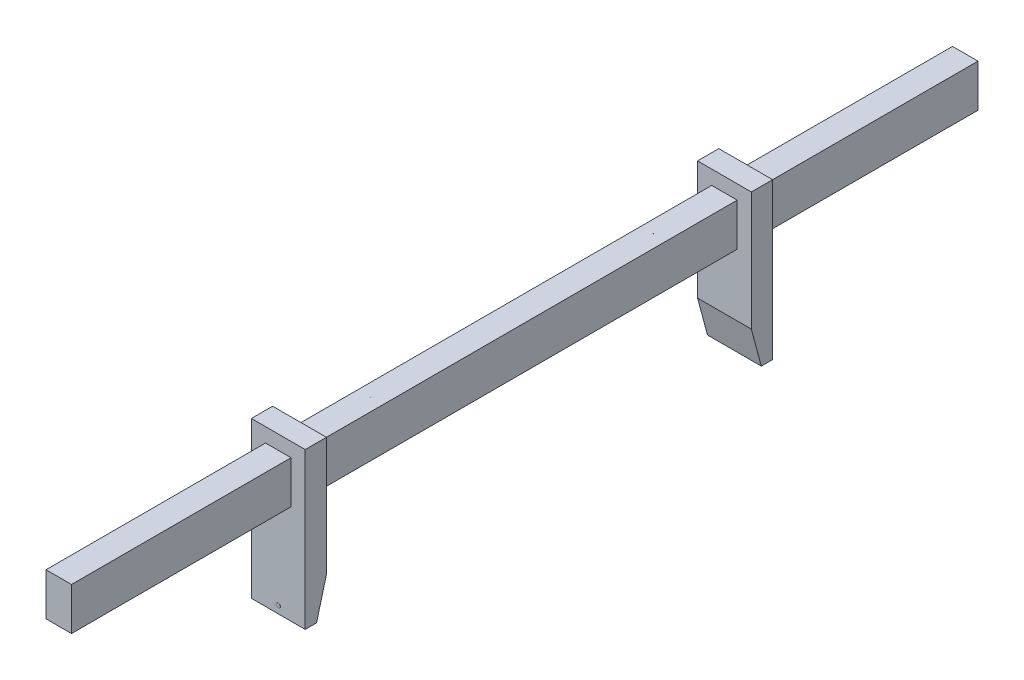
from build123d import *

# Parameters (mm, degrees)
SKETCH_1_W      = 18
SKETCH_1_H      = 30
EXTRUDE_1_DEPTH = 300
EXTRUDE_2_DEPTH = 20
EXTRUDE_3_DEPTH = 38
SKETCH_6_R      = 0.25
EXTRUDE_4_DEPTH = 0.05
SKETCH_8_R      = 1.5
EXTRUDE_5_DEPTH = 0.1


with BuildPart() as part:
    # 草图1 → 凸台-拉伸1 (new, symmetric)
    with BuildSketch(Plane.XY):
        Rectangle(SKETCH_1_W, SKETCH_1_H)
    extrude(amount=EXTRUDE_1_DEPTH, both=True)

    # 草图3 → 凸台-拉伸2 (add)
    with BuildSketch(Plane.XY.offset(300)):
        Polygon((-9, -15), (-9, -15.05), (9, -15.05), (9, -15), (9, 15), (-9, 15), align=None)
    extrude_2 = extrude(amount=EXTRUDE_2_DEPTH)

    # 镜向1: 凸台-拉伸2 across plane
    add(extrude_2.mirror(Plane.XY))

    # 草图5 → 凸台-拉伸3 (add)
    with BuildSketch(Plane(origin=(19, 0, 0), x_dir=(0, 0, -1), z_dir=(1, 0, 0))):
        Polygon((-165, 25), (-165, -85), (-157, -85), (-150, -58.875644347), (-150, 25), align=None)
    extrude_3 = extrude(amount=-EXTRUDE_3_DEPTH)

    # 镜向2: 凸台-拉伸3 across plane
    add(extrude_3.mirror(Plane.XY))

    # 草图6 → 凸台-拉伸4 (add)
    with BuildSketch(Plane(origin=(0, 15, 0), x_dir=(1, 0, 0), z_dir=(0, 1, 0))):
        with Locations(Location((0, 100, 0), (0, 0, 90))):
            Circle(SKETCH_6_R)
    extrude_4 = extrude(amount=EXTRUDE_4_DEPTH)

    # 镜向3: 凸台-拉伸4 across plane
    add(extrude_4.mirror(Plane.XY))

    # 草图8 → 凸台-拉伸5 (add)
    with BuildSketch(Plane(origin=(0, -26.505017173, 165), x_dir=(1, 0, 0), z_dir=(0, 0, 1))):
        with Locations((0, -53.331799003)):
            Circle(SKETCH_8_R)
    extrude_5 = extrude(amount=EXTRUDE_5_DEPTH)

    # 镜向4: 凸台-拉伸5 across plane
    add(extrude_5.mirror(Plane.XY))


solid = part.part
